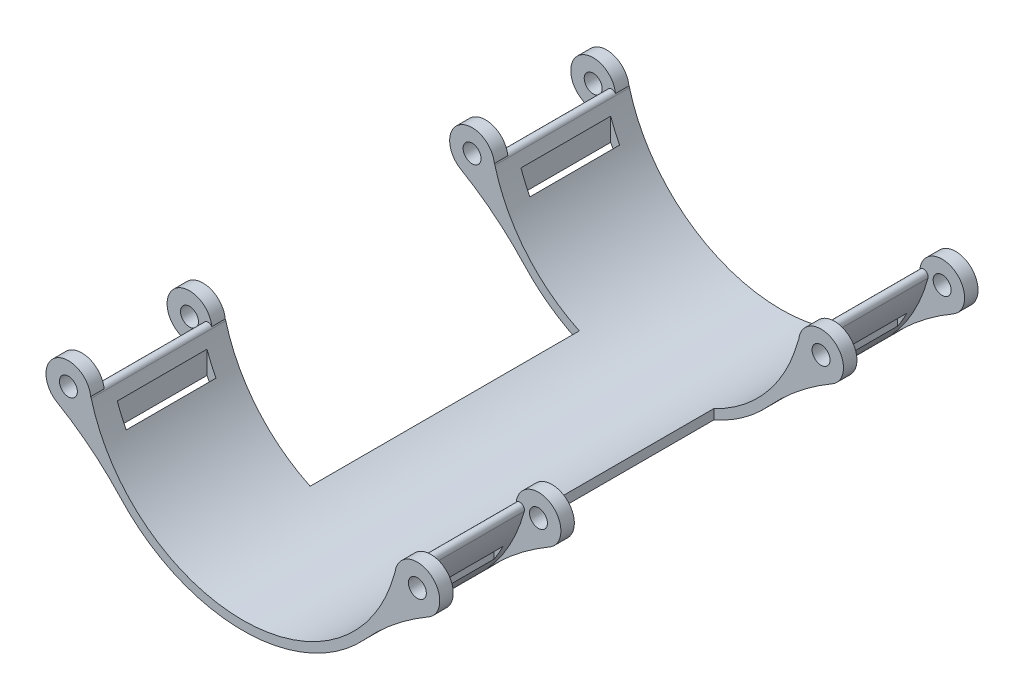
from build123d import *

# Parameters (mm, degrees)
BOSS_EXTRUDE1_DEPTH = 120
SKETCH2_W           = 40.109469753
SKETCH2_H           = 60
SKETCH2_W_2         = 2
SKETCH2_H_2         = 20
CUT_EXTRUDE1_DEPTH  = 120
SKETCH3_R           = 5
SKETCH3_R_2         = 2
BOSS_EXTRUDE2_DEPTH = 3
BOSS_EXTRUDE3_START = -3
SKETCH4_R           = 5
SKETCH4_R_2         = 2
BOSS_EXTRUDE3_DEPTH = 3
LPATTERN1_COUNT     = 2
LPATTERN1_PITCH     = 90
FILLET1_R           = 60


with BuildPart() as part:
    # Sketch1 → Boss-Extrude1 (new body)
    with BuildSketch(Plane.XY):
        with BuildLine():
            ThreePointArc((33.80740392, -9.058666579), (0, -35), (-33.80740392, -9.058666579))
            ThreePointArc((-33.80740392, -9.058666579), (-35.032148792, -8.351559797), (-35.739255573, -9.576304669))
            ThreePointArc((-35.739255573, -9.576304669), (0, -37), (35.739255573, -9.576304669))
            ThreePointArc((35.739255573, -9.576304669), (35.032148792, -8.351559797), (33.80740392, -9.058666579))
        make_face()
    extrude(amount=BOSS_EXTRUDE1_DEPTH)

    # Sketch2 → Cut-Extrude1 (cut)
    with BuildSketch(Plane(origin=(0, 0, 0), x_dir=(1, 0, 0), z_dir=(0, 1, 0))):
        with Locations((-35.054734877, -60)):
            Rectangle(SKETCH2_W, SKETCH2_H)
        with Locations((35.054734877, -60)):
            Rectangle(SKETCH2_W, SKETCH2_H)
        with Locations((32, -15)):
            Rectangle(SKETCH2_W_2, SKETCH2_H_2)
        with Locations((-32, -15)):
            Rectangle(SKETCH2_W_2, SKETCH2_H_2)
        with Locations((-32, -105)):
            Rectangle(SKETCH2_W_2, SKETCH2_H_2)
        with Locations((32, -105)):
            Rectangle(SKETCH2_W_2, SKETCH2_H_2)
    extrude(amount=-CUT_EXTRUDE1_DEPTH, mode=Mode.SUBTRACT)

    # Sketch3 → Boss-Extrude2 (add)
    # profile 1 of 2: a face of its own
    with BuildSketch(Plane(origin=(0, 0, 0), x_dir=(-1, 0, 0), z_dir=(0, 0, -1))):
        with Locations((-38.899671742, -9.317485624)):
            Circle(SKETCH3_R)
        with Locations((-38.899671742, -9.317485624)):
            Circle(SKETCH3_R_2, mode=Mode.SUBTRACT)
    # profile 2 of 2: a face of its own
    with BuildSketch(Plane(origin=(0, 0, 0), x_dir=(-1, 0, 0), z_dir=(0, 0, -1))):
        with Locations((38.899671742, -9.317485624)):
            Circle(SKETCH3_R)
        with Locations(Location((38.899671742, -9.317485624, 0), (0, 0, 180))):
            Circle(SKETCH3_R_2, mode=Mode.SUBTRACT)
    boss_extrude2 = extrude(amount=-BOSS_EXTRUDE2_DEPTH)

    # Sketch4 → Boss-Extrude3 (add)
    # profile 1 of 2: a face of its own
    with BuildSketch(Plane.XY.offset(30).offset(BOSS_EXTRUDE3_START)):
        with Locations((-38.899671742, -9.317485624)):
            Circle(SKETCH4_R)
        with Locations((-38.899671742, -9.317485624)):
            Circle(SKETCH4_R_2, mode=Mode.SUBTRACT)
    # profile 2 of 2: a face of its own
    with BuildSketch(Plane.XY.offset(30).offset(BOSS_EXTRUDE3_START)):
        with Locations((38.899671742, -9.317485624)):
            Circle(SKETCH4_R)
        with Locations(Location((38.899671742, -9.317485624, 0), (0, 0, 180))):
            Circle(SKETCH4_R_2, mode=Mode.SUBTRACT)
    boss_extrude3 = extrude(amount=BOSS_EXTRUDE3_DEPTH)

    # LPattern1: Boss-Extrude2, Boss-Extrude3 ×2
    with Locations(*[(0, 0, i * LPATTERN1_PITCH) for i in range(1, LPATTERN1_COUNT)]):
        add(boss_extrude2)
        add(boss_extrude3)

    # Fillet1
    fillet1_edges = [part.edges().sort_by_distance(p)[0] for p in [
        (34.892782732, -12.308278238, 1.5),
        (-34.892782732, -12.308278238, 1.5),
        (-34.892782732, -12.308278238, 28.5),
        (34.892782732, -12.308278238, 28.5),
        (34.892782732, -12.308278238, 91.5),
        (-34.892782732, -12.308278238, 91.5),
        (-34.892782732, -12.308278238, 118.5),
        (34.892782732, -12.308278238, 118.5),
    ]]
    fillet(fillet1_edges, radius=FILLET1_R)


solid = part.part
